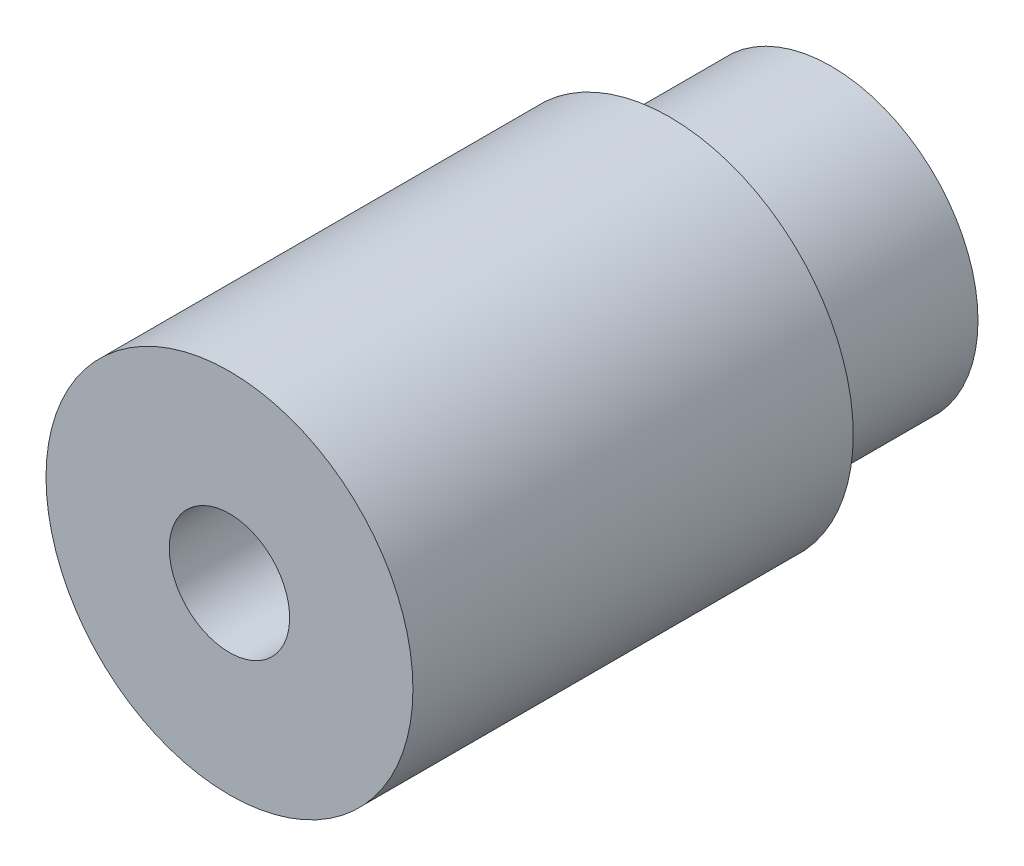
from build123d import *

# Parameters (mm, degrees)
SKETCH1_R           = 12.5
BOSS_EXTRUDE1_DEPTH = 30
SKETCH2_R           = 10
BOSS_EXTRUDE2_DEPTH = 11
SKETCH3_R           = 4.1
CUT_EXTRUDE1_DEPTH  = 318.401165719


with BuildPart() as part:
    # Sketch1 → Boss-Extrude1 (new body)
    with BuildSketch(Plane.XY):
        with Locations((25, -300)):
            Circle(SKETCH1_R)
    extrude(amount=-BOSS_EXTRUDE1_DEPTH)

    # Sketch2 → Boss-Extrude2 (add)
    with BuildSketch(Plane(origin=(0, 0, -30), x_dir=(-1, 0, 0), z_dir=(0, 0, -1))):
        with Locations(Location((-25, -300, 0), (0, 0, 180))):
            Circle(SKETCH2_R)
    extrude(amount=BOSS_EXTRUDE2_DEPTH)

    # Sketch3 → Cut-Extrude1 (cut, through all)
    with BuildSketch(Plane(origin=(0, 0, -41), x_dir=(-1, 0, 0), z_dir=(0, 0, -1))):
        with Locations((-25, -300)):
            Circle(SKETCH3_R)
    extrude(amount=-CUT_EXTRUDE1_DEPTH, mode=Mode.SUBTRACT)


solid = part.part
